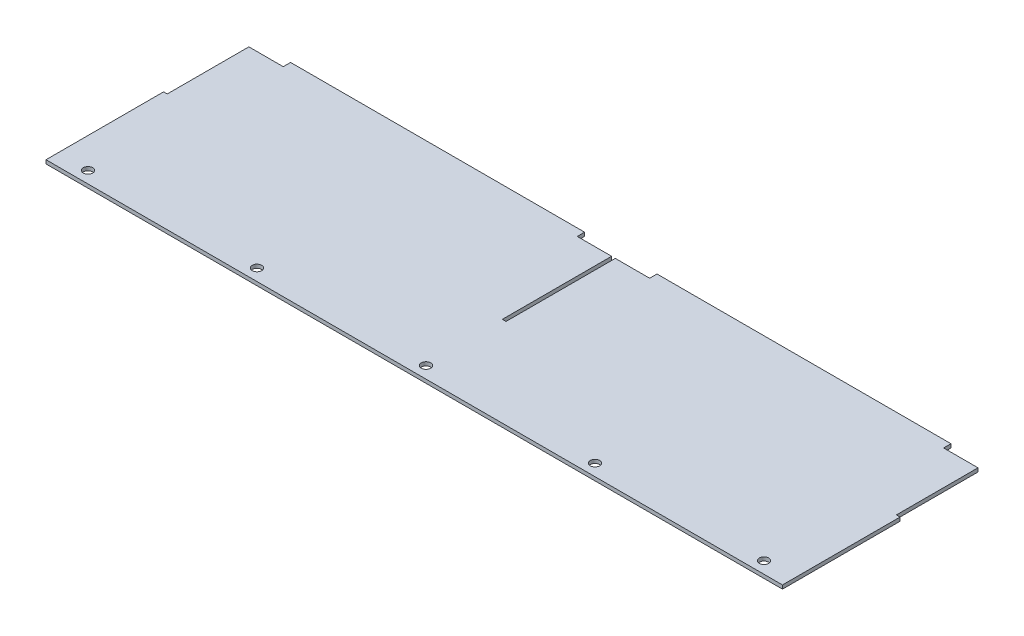
from build123d import *

# Parameters (mm, degrees)
SKETCH1_W           = 636.25984
SKETCH1_H           = 172.09262
BOSS_EXTRUDE1_DEPTH = 3.175
SKETCH2_W           = 3.175
SKETCH2_H           = 3.175
CUT_EXTRUDE1_DEPTH  = 94.36608
SKETCH3_W           = 3.175
SKETCH3_H           = 3.175
CUT_EXTRUDE5_DEPTH  = 70.49262
SKETCH4_W           = 636.25984
SKETCH4_H           = 24.39416
CUT_EXTRUDE6_DEPTH  = 660.130134708
SKETCH6_W           = 636.25984
SKETCH6_H           = 24.39416
BOSS_EXTRUDE2_DEPTH = 3.175
SKETCH7_W           = 254
SKETCH7_H           = 3.175
BOSS_EXTRUDE3_DEPTH = 6.35
SKETCH8_R           = 4.064
CUT_EXTRUDE7_DEPTH  = 661.816489847


with BuildPart() as part:
    # Sketch1 → Boss-Extrude1 (new body)
    with BuildSketch(Plane(origin=(0, 0, 0), x_dir=(1, 0, 0), z_dir=(0, 1, 0))):
        with Locations((318.12992, 86.04631)):
            Rectangle(SKETCH1_W, SKETCH1_H)
    extrude(amount=BOSS_EXTRUDE1_DEPTH)

    # Sketch2 → Cut-Extrude1 (cut)
    with BuildSketch(Plane(origin=(0, 0, -172.09262), x_dir=(-1, 0, 0), z_dir=(0, 0, -1))):
        with Locations((-318.12992, 1.5875)):
            Rectangle(SKETCH2_W, SKETCH2_H)
    extrude(amount=-CUT_EXTRUDE1_DEPTH, mode=Mode.SUBTRACT)

    # Sketch3 → Cut-Extrude5 (cut)
    with BuildSketch(Plane.XY.offset(-172.09262)):
        with Locations((1.5875, 1.5875)):
            Rectangle(SKETCH3_W, SKETCH3_H)
        with Locations((634.67234, 1.5875)):
            Rectangle(SKETCH3_W, SKETCH3_H)
    extrude(amount=CUT_EXTRUDE5_DEPTH, mode=Mode.SUBTRACT)

    # Sketch4 → Cut-Extrude6 (cut, through all)
    with BuildSketch(Plane(origin=(0, 3.175, 0), x_dir=(1, 0, 0), z_dir=(0, 1, 0))):
        with Locations((318.12992, 12.19708)):
            Rectangle(SKETCH4_W, SKETCH4_H)
    extrude(amount=-CUT_EXTRUDE6_DEPTH, mode=Mode.SUBTRACT)

    # Sketch6 → Boss-Extrude2 (add, through all)
    with BuildSketch(Plane(origin=(0, 3.175, 0), x_dir=(1, 0, 0), z_dir=(0, 1, 0))):
        with Locations((318.12992, 12.19708)):
            Rectangle(SKETCH6_W, SKETCH6_H)
    extrude(amount=-BOSS_EXTRUDE2_DEPTH)

    # Sketch7 → Boss-Extrude3 (add)
    with BuildSketch(Plane(origin=(0, 0, -172.09262), x_dir=(-1, 0, 0), z_dir=(0, 0, -1))):
        with Locations((-476.40113, 1.5875)):
            Rectangle(SKETCH7_W, SKETCH7_H)
        with Locations((-159.85871, 1.5875)):
            Rectangle(SKETCH7_W, SKETCH7_H)
    extrude(amount=BOSS_EXTRUDE3_DEPTH)

    # Sketch8 → Cut-Extrude7 (cut, through all)
    with BuildSketch(Plane(origin=(0, 3.175, 0), x_dir=(1, 0, 0), z_dir=(0, 1, 0))):
        with Locations(Location((26.107106781, 10.16, 0), (0, 0, 270))):
            Circle(SKETCH8_R)
        with Locations(Location((172.118513391, 10.16, 0), (0, 0, 270))):
            Circle(SKETCH8_R)
        with Locations(Location((318.12992, 10.16, 0), (0, 0, 270))):
            Circle(SKETCH8_R)
        with Locations(Location((464.141326609, 10.16, 0), (0, 0, 270))):
            Circle(SKETCH8_R)
        with Locations(Location((610.152733219, 10.16, 0), (0, 0, 270))):
            Circle(SKETCH8_R)
    extrude(amount=-CUT_EXTRUDE7_DEPTH, mode=Mode.SUBTRACT)


solid = part.part
